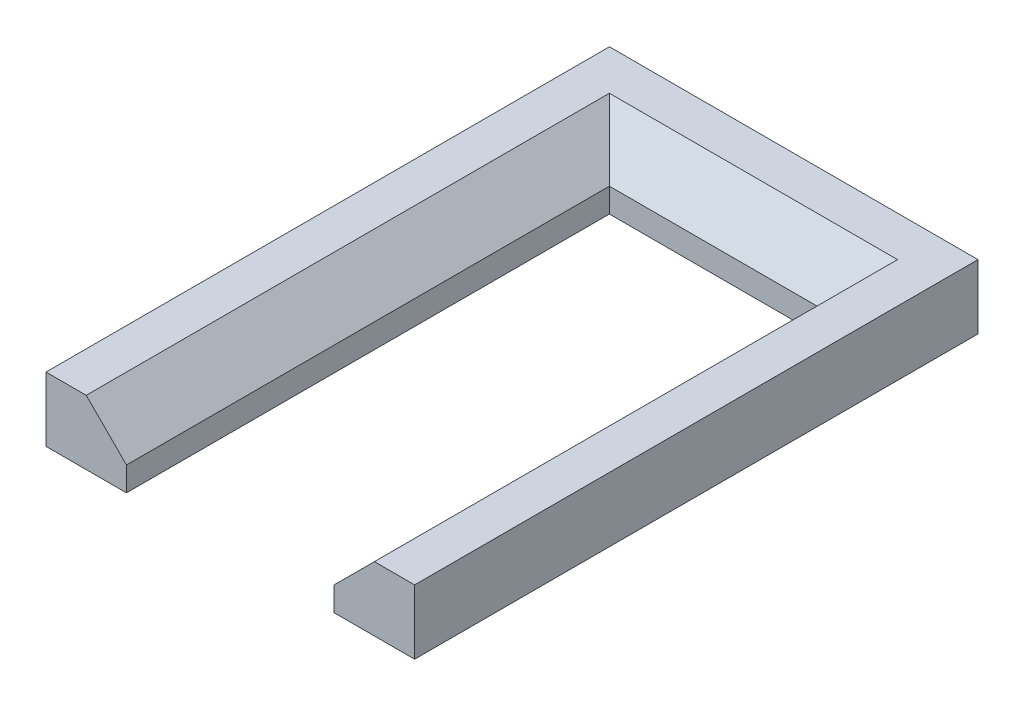
from build123d import *

# Parameters (mm, degrees)
BOSS_EXTRUDE1_DEPTH = 8
CHAMFER1_SIZE       = 5


with BuildPart() as part:
    # Sketch1 → Boss-Extrude1 (new body)
    with BuildSketch(Plane(origin=(0, 0, 0), x_dir=(1, 0, 0), z_dir=(0, 1, 0))):
        Polygon((-22.9, 0), (-12.9, 0), (-12.9, 60), (12.9, 60), (12.9, 0), (22.9, 0), (22.9, 70), (-22.9, 70), align=None)
    extrude(amount=BOSS_EXTRUDE1_DEPTH)

    # Chamfer1
    chamfer1_edges = [part.edges().sort_by_distance(p)[0] for p in [
        (-12.9, 8, -30),
        (0, 8, -60),
        (12.9, 8, -30),
    ]]
    chamfer(chamfer1_edges, length=CHAMFER1_SIZE)


solid = part.part
